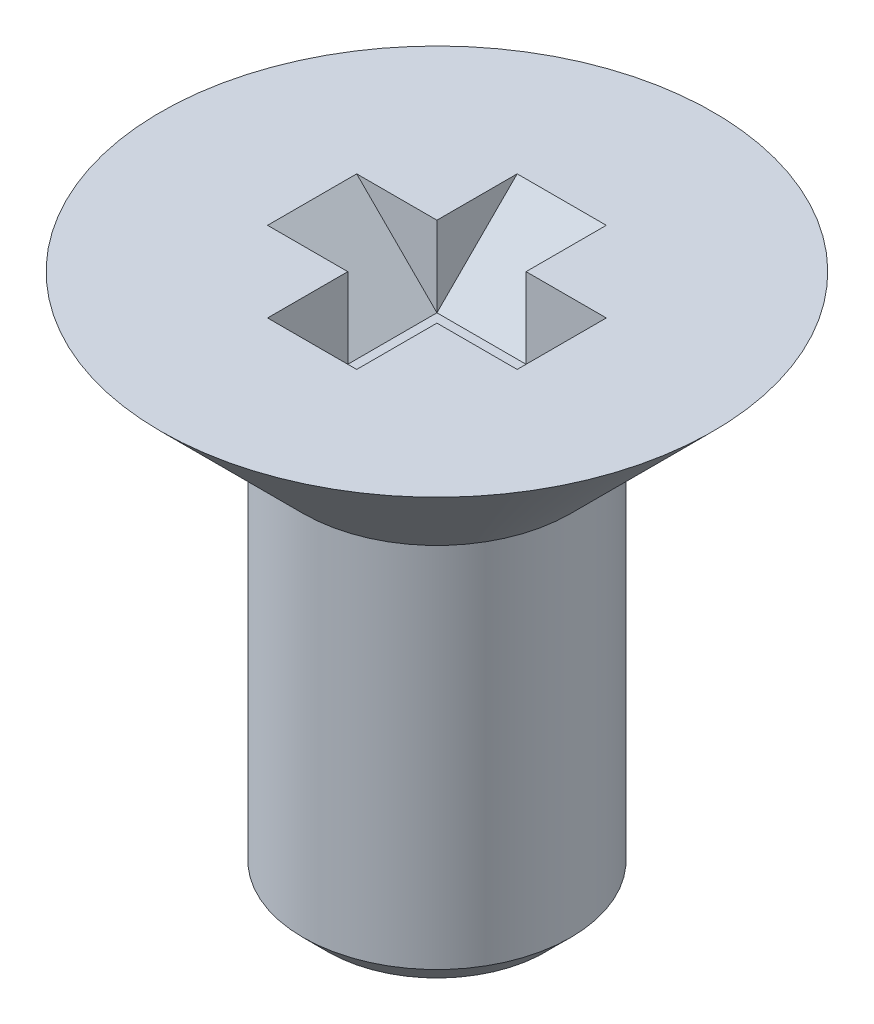
from build123d import *

# Parameters (mm, degrees)
CHAMFER_1_SIZE           = 0.2805
CUT_EXTRUDE_1_DEPTH      = 0.5
PATTERN_CIRCULAR_1_COUNT = 4
SKETCH_3_W               = 1
SKETCH_3_H               = 1
EXTRUDE_1_DEPTH          = 2


with BuildPart() as part:
    # Эскиз1 → Повернуть1 (revolve)
    with BuildSketch(Plane.XY):
        Polygon((0, 0), (3.1, 0), (1.5, -1.6), (1.5, -6), (0, -6), align=None)
    revolve(axis=Axis((0, 0, 0), (0, -1, 0)))

    # Фаска1
    chamfer_1_edges = [part.edges().sort_by_distance(p)[0] for p in [
        (-1.5, -6, 0),
    ]]
    chamfer(chamfer_1_edges, length=CHAMFER_1_SIZE)

    # Эскиз2 → Вырез-Вытянуть1 (cut, symmetric)
    with BuildSketch(Plane.XY):
        Polygon((0, 0), (0, -1.4), (-1.4, 0), align=None)
    cut_extrude_1 = extrude(amount=CUT_EXTRUDE_1_DEPTH, both=True, mode=Mode.SUBTRACT)

    # Круговой массив1: Вырез-Вытянуть1 ×4 about axis
    pattern_circular_1_axis = Axis((0, -1.6, 0), (0, -1, 0))
    for i in range(1, PATTERN_CIRCULAR_1_COUNT):
        add(cut_extrude_1.rotate(pattern_circular_1_axis, i * 360 / PATTERN_CIRCULAR_1_COUNT), mode=Mode.SUBTRACT)

    # Эскиз3 → Бобышка-Вытянуть1 (add)
    with BuildSketch(Plane(origin=(0, -0.9, 0), x_dir=(1, 0, 0), z_dir=(0, 1, 0))):
        Rectangle(SKETCH_3_W, SKETCH_3_H)
    extrude(amount=-EXTRUDE_1_DEPTH)


solid = part.part
